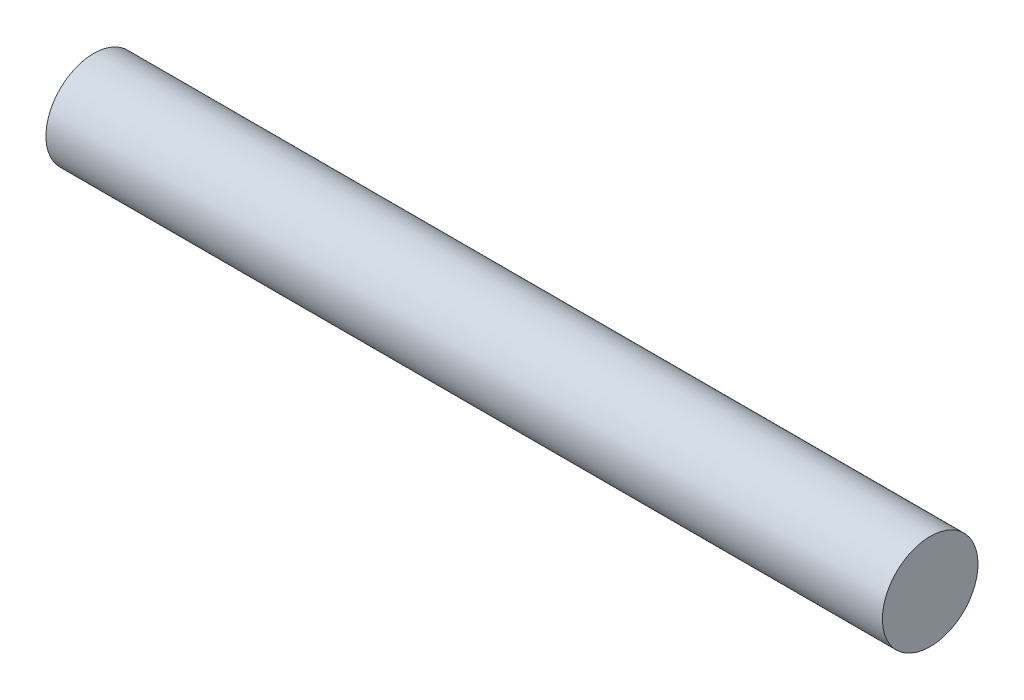
from build123d import *

# Parameters (mm, degrees)
SKETCH_1_R      = 4
EXTRUDE_1_DEPTH = 70


with BuildPart() as part:
    # 草图1 → 凸台-拉伸1 (new body)
    with BuildSketch(Plane(origin=(0, 0, 0), x_dir=(0, 0, -1), z_dir=(1, 0, 0))):
        Circle(SKETCH_1_R)
    extrude(amount=EXTRUDE_1_DEPTH)


solid = part.part
